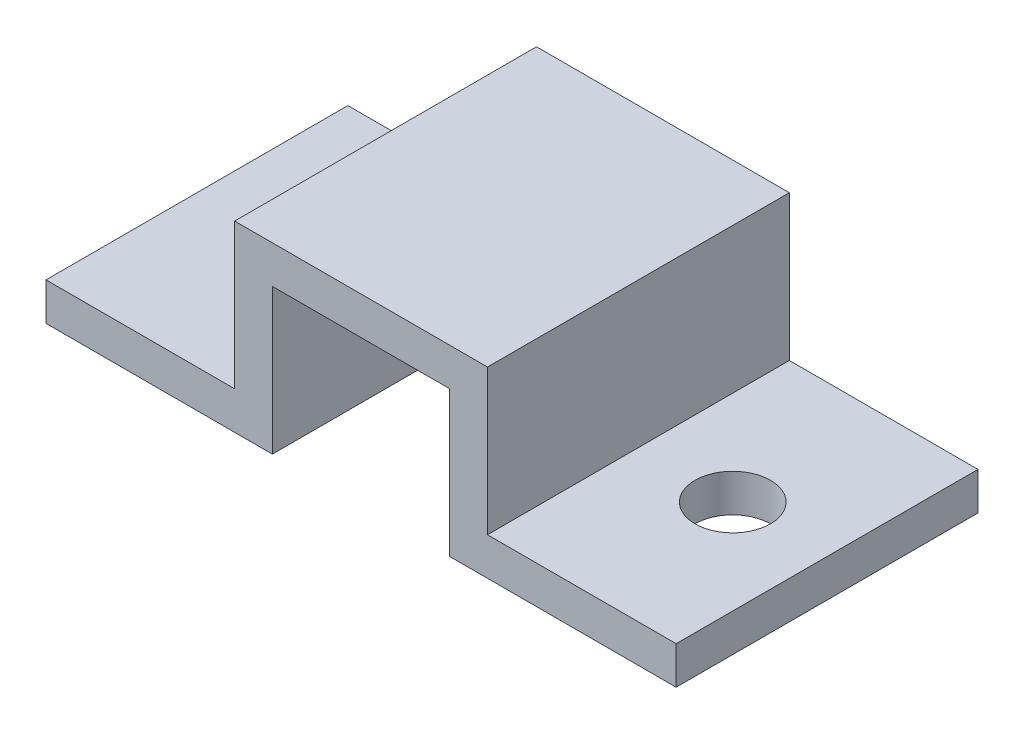
from build123d import *

# Parameters (mm, degrees)
SKETCH2_W           = 42.418
SKETCH2_H           = 20.32
BOSS_EXTRUDE1_DEPTH = 12.319
SKETCH5_W           = 12.7
SKETCH5_H           = 20.32
CUT_EXTRUDE1_DEPTH  = 9.779
SKETCH6_W           = 12.7
SKETCH6_H           = 20.32
CUT_EXTRUDE2_DEPTH  = 9.779
SKETCH7_W           = 11.938
SKETCH7_H           = 20.32
CUT_EXTRUDE3_DEPTH  = 9.779
SKETCH8_R           = 2.54
CUT_EXTRUDE4_DEPTH  = 2.54
SKETCH9_R           = 2.54
CUT_EXTRUDE5_DEPTH  = 2.54


with BuildPart() as part:
    # Sketch2 → Boss-Extrude1 (new body)
    with BuildSketch(Plane(origin=(0, 0, 0), x_dir=(1, 0, 0), z_dir=(0, 1, 0))):
        with Locations((15.610403741, -5.358242937)):
            Rectangle(SKETCH2_W, SKETCH2_H)
    extrude(amount=BOSS_EXTRUDE1_DEPTH)

    # Sketch5 → Cut-Extrude1 (cut)
    with BuildSketch(Plane(origin=(0, 12.319, 0), x_dir=(1, 0, 0), z_dir=(0, 1, 0))):
        with Locations((0.751403741, -5.358242937)):
            Rectangle(SKETCH5_W, SKETCH5_H)
    extrude(amount=-CUT_EXTRUDE1_DEPTH, mode=Mode.SUBTRACT)

    # Sketch6 → Cut-Extrude2 (cut)
    with BuildSketch(Plane(origin=(0, 12.319, 0), x_dir=(1, 0, 0), z_dir=(0, 1, 0))):
        with Locations((30.469403741, -5.358242937)):
            Rectangle(SKETCH6_W, SKETCH6_H)
    extrude(amount=-CUT_EXTRUDE2_DEPTH, mode=Mode.SUBTRACT)

    # Sketch7 → Cut-Extrude3 (cut)
    with BuildSketch(Plane(origin=(0, 0, 0), x_dir=(-1, 0, 0), z_dir=(0, -1, 0))):
        with Locations((-15.610403741, -5.358242937)):
            Rectangle(SKETCH7_W, SKETCH7_H)
    extrude(amount=-CUT_EXTRUDE3_DEPTH, mode=Mode.SUBTRACT)

    # Sketch8 → Cut-Extrude4 (cut)
    with BuildSketch(Plane(origin=(0, 2.54, 0), x_dir=(1, 0, 0), z_dir=(0, 1, 0))):
        with Locations(Location((0.751403741, -5.358242937, 0), (0, 0, 270))):
            Circle(SKETCH8_R)
    extrude(amount=-CUT_EXTRUDE4_DEPTH, mode=Mode.SUBTRACT)

    # Sketch9 → Cut-Extrude5 (cut)
    with BuildSketch(Plane(origin=(0, 2.54, 0), x_dir=(1, 0, 0), z_dir=(0, 1, 0))):
        with Locations(Location((30.469403741, -5.358242937, 0), (0, 0, 270))):
            Circle(SKETCH9_R)
    extrude(amount=-CUT_EXTRUDE5_DEPTH, mode=Mode.SUBTRACT)


solid = part.part
